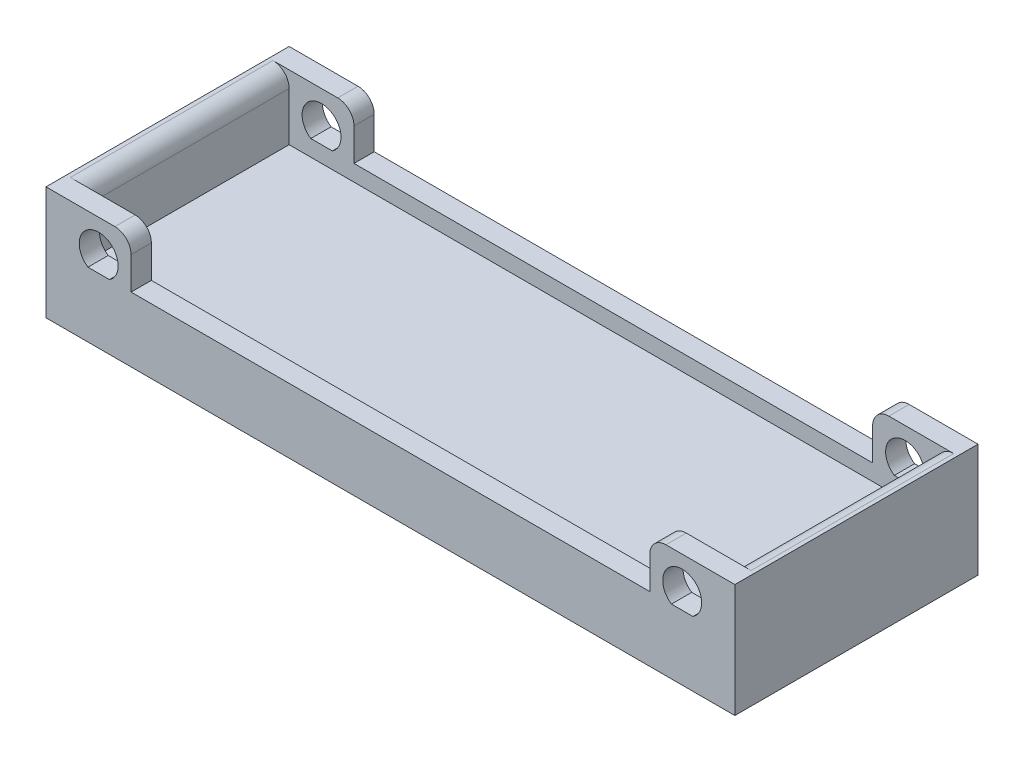
from build123d import *

# Parameters (mm, degrees)
SKETCH1_W            = 85
SKETCH1_H            = 8
BOSS_EXTRUDE1_DEPTH  = 30
SKETCH2_W            = 80
SKETCH2_H            = 25
CUT_EXTRUDE1_DEPTH   = 2
BOSS_EXTRUDE3_DEPTH  = 6
M4_CLEARANCE_HOLE1_D = 4.8
FILLET1_R            = 2


with BuildPart() as part:
    # Sketch1 → Boss-Extrude1 (new body)
    with BuildSketch(Plane.XY):
        Rectangle(SKETCH1_W, SKETCH1_H)
    extrude(amount=BOSS_EXTRUDE1_DEPTH)

    # Sketch2 → Cut-Extrude1 (cut)
    with BuildSketch(Plane(origin=(0, 4, 0), x_dir=(1, 0, 0), z_dir=(0, 1, 0))):
        with Locations((0, -15)):
            Rectangle(SKETCH2_W, SKETCH2_H)
    extrude(amount=-CUT_EXTRUDE1_DEPTH, mode=Mode.SUBTRACT)

    # Sketch3 → Boss-Extrude3 (add)
    with BuildSketch(Plane(origin=(0, 4, 0), x_dir=(1, 0, 0), z_dir=(0, 1, 0))):
        Polygon((-32, 0), (-42.5, 0), (-42.5, -30), (-32, -30), (-32, -27.5), (-40, -27.5), (-40, -2.5), (-32, -2.5), align=None)
    extrude(amount=BOSS_EXTRUDE3_DEPTH)

    # M4 Clearance Hole1 (through all)
    with Locations(Plane.XY.offset(30)):
        with Locations((-36, 6)):
            Hole(M4_CLEARANCE_HOLE1_D / 2)

    # Fillet1
    fillet1_edges = [part.edges().sort_by_distance(p)[0] for p in [
        (-32, 10, 1.25),
        (-32, 10, 28.75),
        (-40, 10, 15),
    ]]
    fillet(fillet1_edges, radius=FILLET1_R)

    # Mirror1: part across plane


with BuildPart() as part_1:
    add(part.part)
    add(part.part.mirror(Plane(origin=(0, 0, 0), x_dir=(0, 0, 1), z_dir=(1, 0, 0))))


solid = part_1.part
